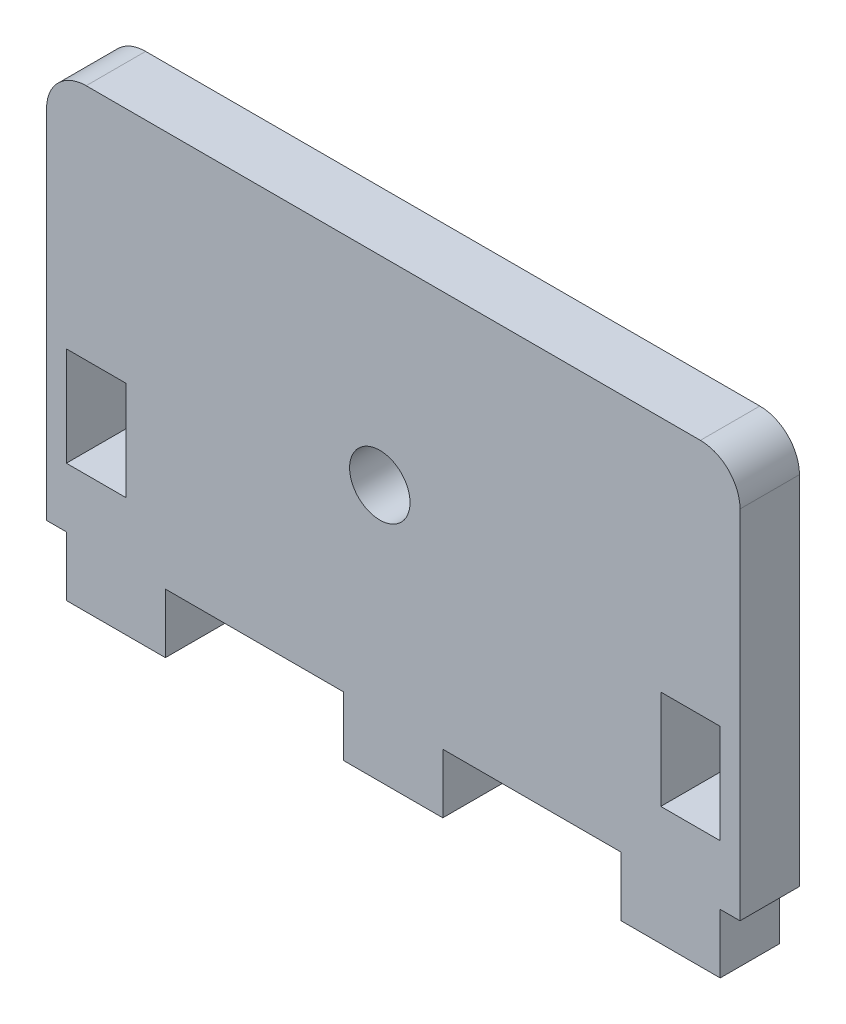
from build123d import *

# Parameters (mm, degrees)
BOSS_EXTRUDE1_DEPTH = 3
FILLET1_R           = 2
SKETCH4_R           = 1.525
SKETCH4_W           = 3
SKETCH4_H           = 5
CUT_EXTRUDE1_DEPTH  = 23.005681085


with BuildPart() as part:
    # Sketch1 → Boss-Extrude1 (new body)
    with BuildSketch(Plane.XY):
        Polygon((-11.5, -10), (-2.5, -10), (-2.5, -13), (2.5, -13), (2.5, -10), (11.5, -10), (11.5, -13), (16.5, -13), (16.5, -10), (17.5, -10), (17.5, 10), (-17.5, 10), (-17.5, -10), (-16.5, -10), (-16.5, -13), (-11.5, -13), align=None)
    extrude(amount=BOSS_EXTRUDE1_DEPTH)

    # Fillet1
    fillet1_edges = [part.edges().sort_by_distance(p)[0] for p in [
        (-17.5, 10, 1.5),
        (17.5, 10, 1.5),
    ]]
    fillet(fillet1_edges, radius=FILLET1_R)

    # Sketch4 → Cut-Extrude1 (cut, through all)
    with BuildSketch(Plane.XY.offset(3)):
        with Locations((-0.68, -0.05)):
            Circle(SKETCH4_R)
        with Locations((-15, -4.5)):
            Rectangle(SKETCH4_W, SKETCH4_H)
        with Locations((15, -4.5)):
            Rectangle(SKETCH4_W, SKETCH4_H)
    extrude(amount=-CUT_EXTRUDE1_DEPTH, mode=Mode.SUBTRACT)


solid = part.part
